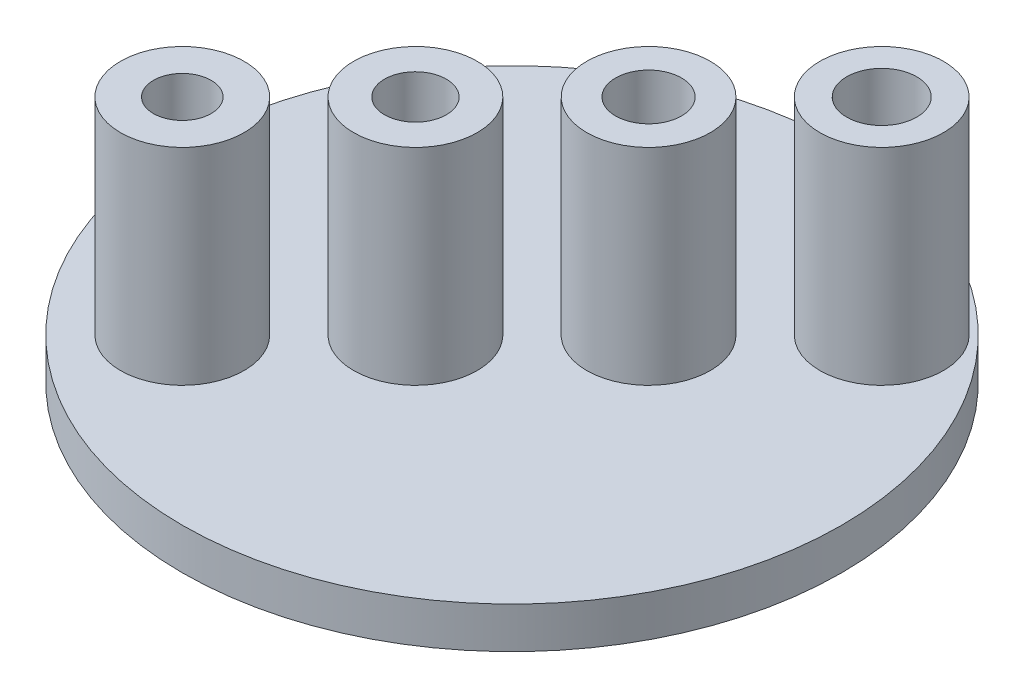
from build123d import *

# Parameters (mm, degrees)
SKETCH3_R           = 10.16
BOSS_EXTRUDE1_DEPTH = 1.27
SKETCH4_R           = 1.905
BOSS_EXTRUDE2_DEPTH = 6.35
LPATTERN1_COUNT     = 4
LPATTERN1_PITCH     = 5.08
SKETCH6_R           = 0.889
CUT_EXTRUDE1_DEPTH  = 6.35
SKETCH7_R           = 0.9525
CUT_EXTRUDE2_DEPTH  = 6.35
SKETCH8_R           = 1.016
CUT_EXTRUDE3_DEPTH  = 6.35
SKETCH9_R           = 1.0795
CUT_EXTRUDE4_DEPTH  = 6.35


with BuildPart() as part:
    # Sketch3 → Boss-Extrude1 (new body)
    with BuildSketch(Plane(origin=(0, 0, 0), x_dir=(1, 0, 0), z_dir=(0, 1, 0))):
        with Locations(Location((0, 0, 0), (0, 0, 270))):
            Circle(SKETCH3_R)
    extrude(amount=BOSS_EXTRUDE1_DEPTH)

    # Sketch4 → Boss-Extrude2 (add)
    with BuildSketch(Plane(origin=(0, 1.27, 0), x_dir=(1, 0, 0), z_dir=(0, 1, 0))):
        with Locations(Location((-5.08, -5.08, 0), (0, 0, 270))):
            Circle(SKETCH4_R)
    boss_extrude2 = extrude(amount=BOSS_EXTRUDE2_DEPTH)

    # LPattern1: Boss-Extrude2 ×4
    with Locations(*[Vector(0.7071067811865476, 0, -0.7071067811865476) * (i * LPATTERN1_PITCH) for i in range(1, LPATTERN1_COUNT)]):
        add(boss_extrude2)

    # Sketch6 → Cut-Extrude1 (cut)
    with BuildSketch(Plane(origin=(0, 7.62, 0), x_dir=(1, 0, 0), z_dir=(0, 1, 0))):
        with Locations(Location((-5.08, -5.08, 0), (0, 0, 270))):
            Circle(SKETCH6_R)
    extrude(amount=-CUT_EXTRUDE1_DEPTH, mode=Mode.SUBTRACT)

    # Sketch7 → Cut-Extrude2 (cut)
    with BuildSketch(Plane(origin=(0, 7.62, 0), x_dir=(1, 0, 0), z_dir=(0, 1, 0))):
        with Locations(Location((-1.487897552, -1.487897552, 0), (0, 0, 270))):
            Circle(SKETCH7_R)
    extrude(amount=-CUT_EXTRUDE2_DEPTH, mode=Mode.SUBTRACT)

    # Sketch8 → Cut-Extrude3 (cut)
    with BuildSketch(Plane(origin=(0, 7.62, 0), x_dir=(1, 0, 0), z_dir=(0, 1, 0))):
        with Locations(Location((2.104204897, 2.104204897, 0), (0, 0, 270))):
            Circle(SKETCH8_R)
    extrude(amount=-CUT_EXTRUDE3_DEPTH, mode=Mode.SUBTRACT)

    # Sketch9 → Cut-Extrude4 (cut)
    with BuildSketch(Plane(origin=(0, 7.62, 0), x_dir=(1, 0, 0), z_dir=(0, 1, 0))):
        with Locations(Location((5.696307345, 5.696307345, 0), (0, 0, 270))):
            Circle(SKETCH9_R)
    extrude(amount=-CUT_EXTRUDE4_DEPTH, mode=Mode.SUBTRACT)


solid = part.part
